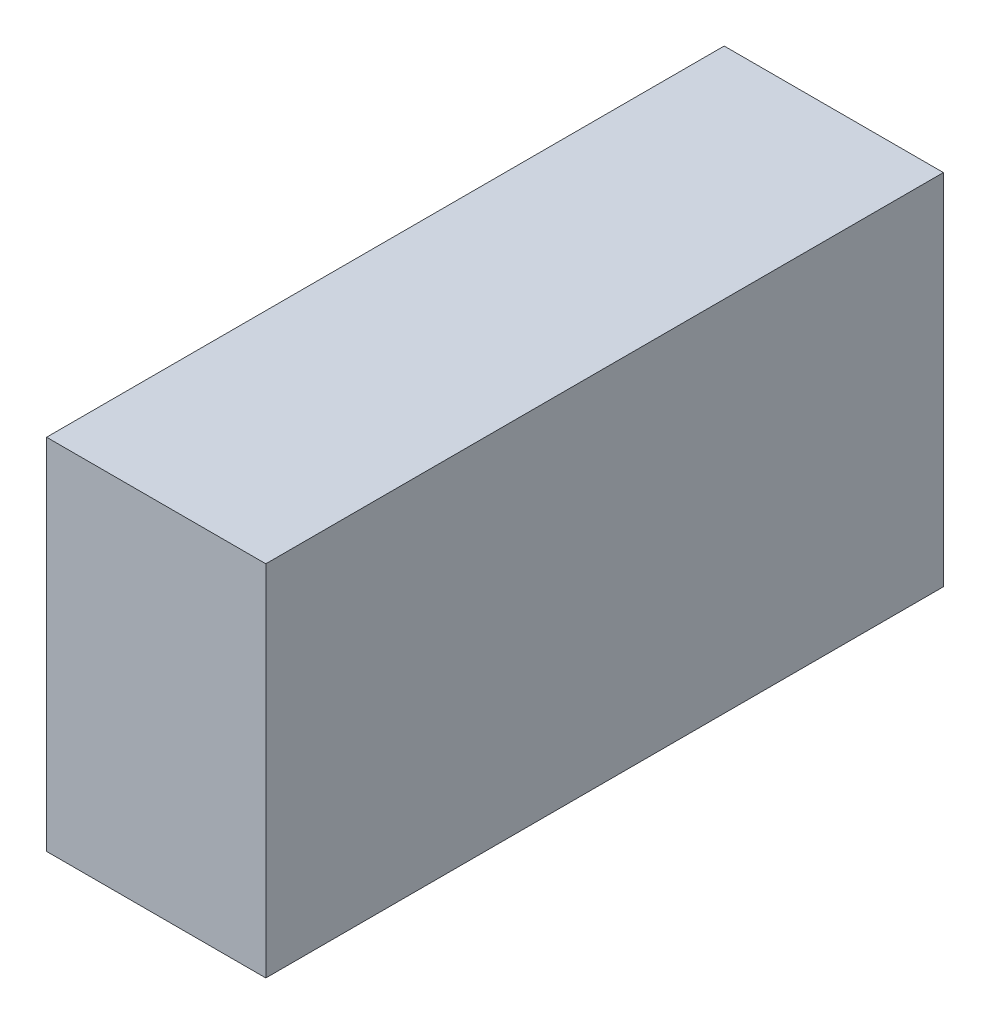
from build123d import *

# Parameters (mm, degrees)
SKETCH1_W           = 34
SKETCH1_H           = 18
BOSS_EXTRUDE1_DEPTH = 11


with BuildPart() as part:
    # Sketch1 → Boss-Extrude1 (new body)
    with BuildSketch(Plane(origin=(12, 0, 0), x_dir=(0, 0, -1), z_dir=(1, 0, 0))):
        with Locations((20, 14)):
            Rectangle(SKETCH1_W, SKETCH1_H)
    extrude(amount=BOSS_EXTRUDE1_DEPTH)


solid = part.part
